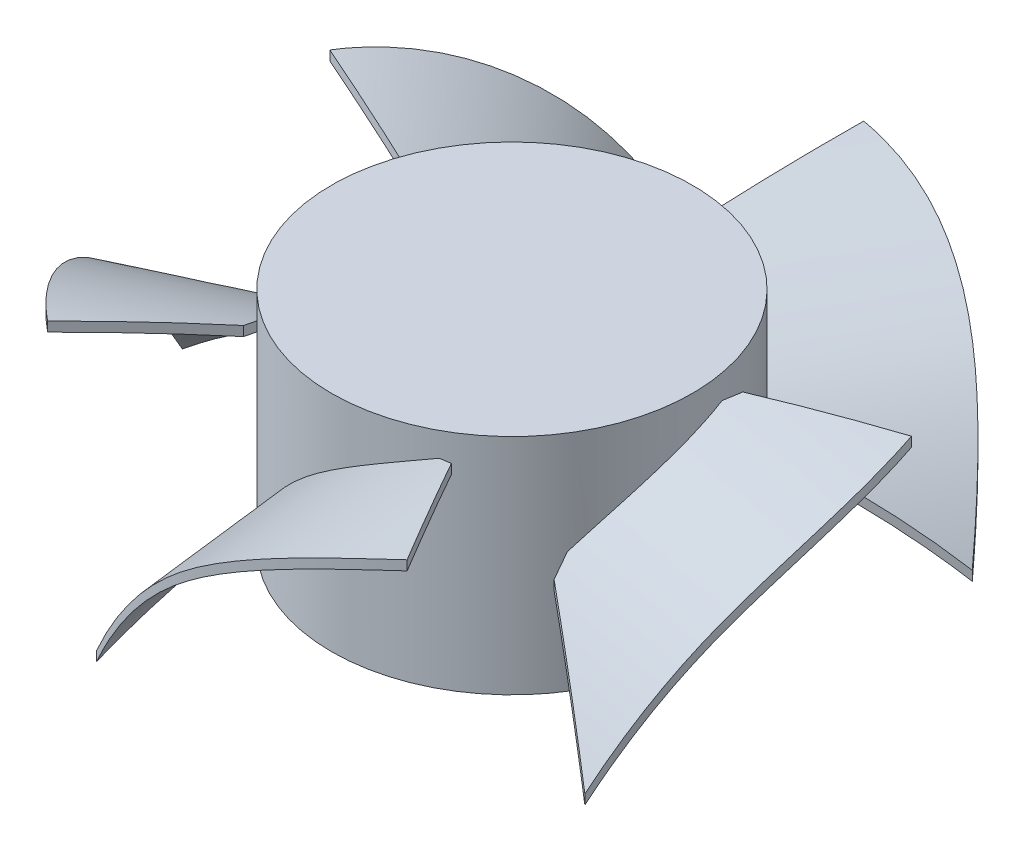
from build123d import *
from build123d.topology import SkipClean

# Parameters (mm, degrees)
SKETCH1_R                           = 7.5
BOSS_EXTRUDE1_DEPTH                 = 9.3
SKETCH2_R                           = 1.5
CUT_EXTRUDE1_DEPTH                  = 7.4
SKETCH3_W                           = 6.2
SKETCH3_H                           = 8.7
REVOLVE1_ANGLE                      = 50
CUT_EXTRUDE2_DEPTH                  = 0.5
CUT_EXTRUDE3_REACH                  = 27.172
CUT_EXTRUDE3_END_RADIUS             = 7.5
CUT_EXTRUDE3_DIRECTION_2_REACH      = 27.172
CUT_EXTRUDE3_DIRECTION_2_END_RADIUS = 13.7
CIRPATTERN1_COUNT                   = 5


with BuildPart() as part:
    # Sketch1 → Boss-Extrude1 (new body)
    with BuildSketch(Plane(origin=(0, 0, 0), x_dir=(1, 0, 0), z_dir=(0, 1, 0))):
        with Locations(Location((0, 0, 0), (0, 0, 270))):
            Circle(SKETCH1_R)
    extrude(amount=BOSS_EXTRUDE1_DEPTH)

    # Sketch2 → Cut-Extrude1 (cut)
    with BuildSketch(Plane.XZ):
        with Locations(Location((0, 0, 0), (0, 0, 270))):
            Circle(SKETCH2_R)
    extrude(amount=-CUT_EXTRUDE1_DEPTH, mode=Mode.SUBTRACT)

    # Sketch3 → Revolve1 (revolve)
    with BuildSketch(Plane.XY):
        with Locations((-10.6, 4.65)):
            Rectangle(SKETCH3_W, SKETCH3_H)
    revolve1 = revolve(axis=Axis((0, 0, 0), (0, 1, 0)), revolution_arc=REVOLVE1_ANGLE)

    # Sketch4 → Cut-Extrude2 (cut)
    with BuildSketch(Plane(origin=(0, 9, 0), x_dir=(1, 0, 0), z_dir=(0, 1, 0))):
        Polygon((-12.382987109, -7.184862919), (-11.369278367, -6.712162769), (-12.449846256, -4.394877453), (-13.463554998, -4.867577602), align=None)
    cut_extrude2 = extrude(amount=-CUT_EXTRUDE2_DEPTH, mode=Mode.SUBTRACT)

    # Cut-Extrude3: up to this cylinder (the profile starts outside it)
    cut_extrude3_end = Plane(origin=(0, 5.151628, 0), z_dir=(0, -1, 0)) * Cylinder(CUT_EXTRUDE3_END_RADIUS, 73.427778, mode=Mode.PRIVATE)
    # Sketch5 → Cut-Extrude3 (cut, up to the surface)
    with BuildSketch(Plane(origin=(-11.909562312, 0, 5.553520111), x_dir=(0.4226182617407003, 0, 0.9063077870366496), z_dir=(-0.9063077870366496, 0, 0.4226182617407003)), mode=Mode.PRIVATE) as cut_extrude3_sk1:
        with BuildLine():
            Line((-5.789870186, 0.3), (5.789870186, 0.3))
            Line((5.789870186, 0.3), (5.789870186, 8.6))
            add(Edge.make_bspline(
                [(5.789870186, 8.6), (3.973177475, 8.345474416), (1.265683904, 7.55460303), (-2.961201189, 4.883119015), (-4.801254593, 2.219383607), (-5.789870186, 0.3)],
                knots=[0, 0, 0, 0, 0.370625426, 0.559828827, 1, 1, 1, 1], degree=3))
        make_face()
    cut_extrude3_tool1 = extrude(cut_extrude3_sk1.sketch, amount=-CUT_EXTRUDE3_REACH, mode=Mode.PRIVATE) - cut_extrude3_end
    # Sketch5 → Cut-Extrude3 (cut, up to the surface)
    with BuildSketch(Plane(origin=(-11.909562312, 0, 5.553520111), x_dir=(0.4226182617407003, 0, 0.9063077870366496), z_dir=(-0.9063077870366496, 0, 0.4226182617407003)), mode=Mode.PRIVATE) as cut_extrude3_sk2:
        with BuildLine():
            Line((5.789870186, 9), (-5.789870186, 9))
            Line((-5.789870186, 9), (-5.789870186, 0.7))
            add(Edge.make_bspline(
                [(5.789870186, 9), (3.973635427, 8.745851073), (1.266789237, 7.954793136), (-2.960064156, 5.283461194), (-4.799996513, 2.619044839), (-5.789870186, 0.7)],
                knots=[0, 0, 0, 0, 0.370525512, 0.559733322, 1, 1, 1, 1], degree=3))
        make_face()
    cut_extrude3_tool2 = extrude(cut_extrude3_sk2.sketch, amount=-CUT_EXTRUDE3_REACH, mode=Mode.PRIVATE) - cut_extrude3_end
    cut_extrude3 = cut_extrude3_tool1.solids().sort_by_distance((-11.367857, 3.609739, 6.715211))[0] + cut_extrude3_tool2.solids().sort_by_distance((-13.098409, 6.693517, 3.004031))[0]
    add(cut_extrude3, mode=Mode.SUBTRACT)

    # Cut-Extrude3 direction 2: up to this cylinder (the profile starts inside it)
    cut_extrude3_direction_2_end = Plane(origin=(0, 5.151628, 0), z_dir=(0, -1, 0)) * Cylinder(CUT_EXTRUDE3_DIRECTION_2_END_RADIUS, 85.827778, mode=Mode.PRIVATE)
    # Sketch5 → Cut-Extrude3 direction 2 (cut, up to the surface)
    with BuildSketch(Plane(origin=(-11.909562312, 0, 5.553520111), x_dir=(0.4226182617407003, 0, 0.9063077870366496), z_dir=(-0.9063077870366496, 0, 0.4226182617407003)), mode=Mode.PRIVATE) as cut_extrude3_direction_2_sk1:
        with BuildLine():
            Line((-5.789870186, 0.3), (5.789870186, 0.3))
            Line((5.789870186, 0.3), (5.789870186, 8.6))
            add(Edge.make_bspline(
                [(5.789870186, 8.6), (3.973177475, 8.345474416), (1.265683904, 7.55460303), (-2.961201189, 4.883119015), (-4.801254593, 2.219383607), (-5.789870186, 0.3)],
                knots=[0, 0, 0, 0, 0.370625426, 0.559828827, 1, 1, 1, 1], degree=3))
        make_face()
    cut_extrude3_direction_2_tool1 = extrude(cut_extrude3_direction_2_sk1.sketch, amount=CUT_EXTRUDE3_DIRECTION_2_REACH, mode=Mode.PRIVATE) & cut_extrude3_direction_2_end
    # Sketch5 → Cut-Extrude3 direction 2 (cut, up to the surface)
    with BuildSketch(Plane(origin=(-11.909562312, 0, 5.553520111), x_dir=(0.4226182617407003, 0, 0.9063077870366496), z_dir=(-0.9063077870366496, 0, 0.4226182617407003)), mode=Mode.PRIVATE) as cut_extrude3_direction_2_sk2:
        with BuildLine():
            Line((5.789870186, 9), (-5.789870186, 9))
            Line((-5.789870186, 9), (-5.789870186, 0.7))
            add(Edge.make_bspline(
                [(5.789870186, 9), (3.973635427, 8.745851073), (1.266789237, 7.954793136), (-2.960064156, 5.283461194), (-4.799996513, 2.619044839), (-5.789870186, 0.7)],
                knots=[0, 0, 0, 0, 0.370525512, 0.559733322, 1, 1, 1, 1], degree=3))
        make_face()
    cut_extrude3_direction_2_tool2 = extrude(cut_extrude3_direction_2_sk2.sketch, amount=CUT_EXTRUDE3_DIRECTION_2_REACH, mode=Mode.PRIVATE) & cut_extrude3_direction_2_end
    cut_extrude3_direction_2 = cut_extrude3_direction_2_tool1.solids().sort_by_distance((-11.367857, 3.609739, 6.715211))[0] + cut_extrude3_direction_2_tool2.solids().sort_by_distance((-13.098409, 6.693517, 3.004031))[0]
    add(cut_extrude3_direction_2, mode=Mode.SUBTRACT)
    cut_extrude3 = cut_extrude3 + cut_extrude3_direction_2  # both directions under the feature's name, for the pattern or mirror that repeats it

    # CirPattern1: Revolve1, Cut-Extrude2, Cut-Extrude3 ×5 about axis
    with SkipClean():  # the faces are left unmerged after this step: merging them gives an invalid solid
        cirpattern1_axis = Axis((0, 0, 0), (0, -1, 0))
        add([revolve1.rotate(cirpattern1_axis, i * 360 / CIRPATTERN1_COUNT) for i in range(1, CIRPATTERN1_COUNT)])
        add([cut_extrude2.rotate(cirpattern1_axis, i * 360 / CIRPATTERN1_COUNT) for i in range(1, CIRPATTERN1_COUNT)], mode=Mode.SUBTRACT)
        add([cut_extrude3.rotate(cirpattern1_axis, i * 360 / CIRPATTERN1_COUNT) for i in range(1, CIRPATTERN1_COUNT)], mode=Mode.SUBTRACT)


solid = part.part
